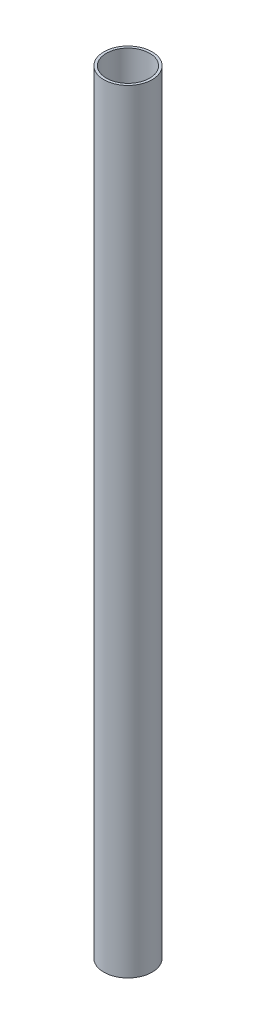
from build123d import *

# Parameters (mm, degrees)
SKETCH130_R                                   = 15.875
SKETCH130_R_2                                 = 14.224
AL_ROUND_TUBING_AL_RND_TUBE_1_25_OD_X_0_DEPTH = 508


with BuildPart() as part:
    # Sketch130 → Al round tubing AL RND TUBE 1.25 OD X 0.063 WALL(1) (new body)
    with BuildSketch(Plane(origin=(0, 0, 0), x_dir=(1, 0, 0), z_dir=(0, 1, 0))):
        Circle(SKETCH130_R)
        Circle(SKETCH130_R_2, mode=Mode.SUBTRACT)
    extrude(amount=AL_ROUND_TUBING_AL_RND_TUBE_1_25_OD_X_0_DEPTH)


solid = part.part
